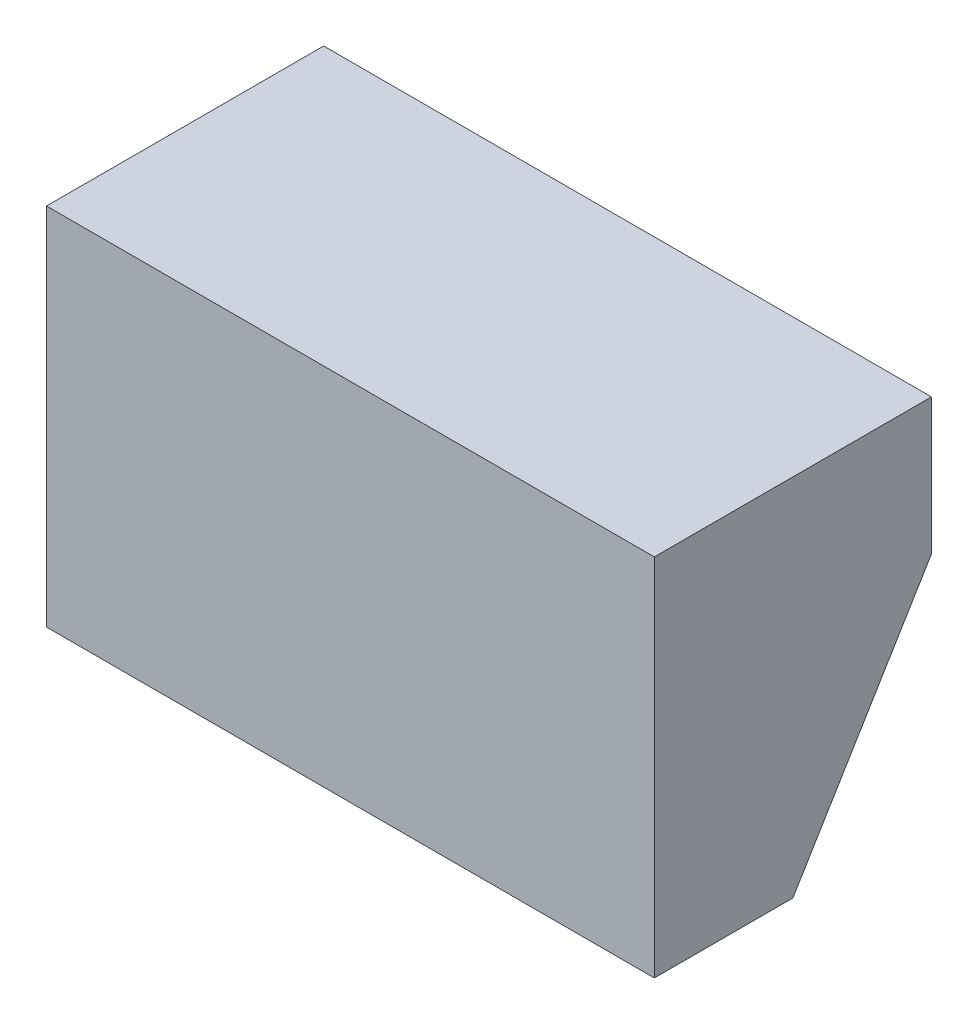
from build123d import *

# Parameters (mm, degrees)
SKETCH1_W           = 250
SKETCH1_H           = 150
BOSS_EXTRUDE1_DEPTH = 114
SKETCH4_W           = 158.825989779
SKETCH4_H           = 169.09880145
CUT_EXTRUDE1_DEPTH  = 114
SKETCH5_R           = 21.25669472
CUT_EXTRUDE2_DEPTH  = 54


with BuildPart() as part:
    # Sketch1 → Boss-Extrude1 (new body)
    with BuildSketch(Plane.XY):
        Rectangle(SKETCH1_W, SKETCH1_H)
    extrude(amount=BOSS_EXTRUDE1_DEPTH)

    # Sketch4 → Cut-Extrude1 (cut)
    with BuildSketch(Plane(origin=(27.906934923, -24.538252492, -40.49320945), x_dir=(0.8614948455361232, 0.2631519435385569, 0.4342553231988889), z_dir=(-0.5077663154588844, 0.4464731827403718, 0.7367734156299286))):
        with Locations((63.082324951, -59.282681283)):
            Rectangle(SKETCH4_W, SKETCH4_H)
    extrude(amount=-CUT_EXTRUDE1_DEPTH, mode=Mode.SUBTRACT)

    # Sketch5 → Cut-Extrude2 (cut)
    with BuildSketch(Plane(origin=(0, 0, 0), x_dir=(-1, 0, 0), z_dir=(0, 0, -1))):
        with Locations((25.521911399, 0)):
            Circle(SKETCH5_R)
    extrude(amount=-CUT_EXTRUDE2_DEPTH, mode=Mode.SUBTRACT)


solid = part.part
